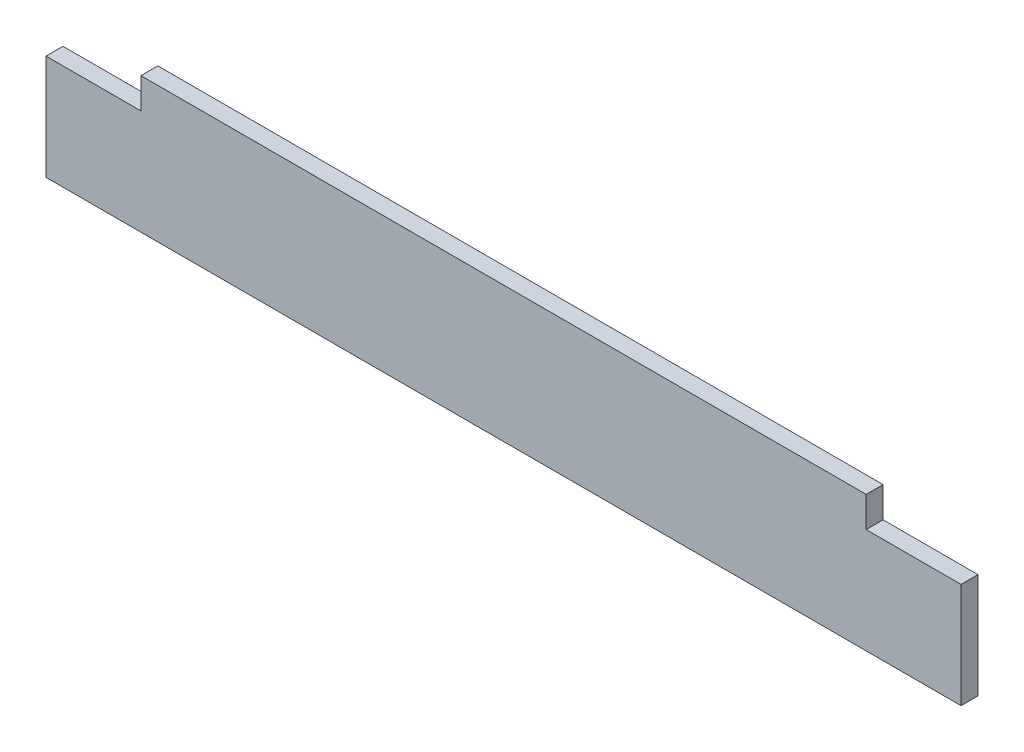
from build123d import *

# Parameters (mm, degrees)
ESQUISSE1_W             = 270
ESQUISSE1_H             = 40
BOSS_EXTRU_1_DEPTH      = 5
ESQUISSE2_W             = 28
ESQUISSE2_H             = 5
ENL_V_MAT_EXTRU_1_DEPTH = 9


with BuildPart() as part:
    # Esquisse1 → Boss.-Extru.1 (new body)
    with BuildSketch(Plane.XY):
        Rectangle(ESQUISSE1_W, ESQUISSE1_H)
    extrude(amount=BOSS_EXTRU_1_DEPTH)

    # Esquisse2 → Enlèv. mat.-Extru.1 (cut)
    with BuildSketch(Plane(origin=(0, 20, 0), x_dir=(1, 0, 0), z_dir=(0, 1, 0))):
        with Locations((121, -2.5)):
            Rectangle(ESQUISSE2_W, ESQUISSE2_H)
        with Locations((-121, -2.5)):
            Rectangle(ESQUISSE2_W, ESQUISSE2_H)
    extrude(amount=-ENL_V_MAT_EXTRU_1_DEPTH, mode=Mode.SUBTRACT)


solid = part.part
